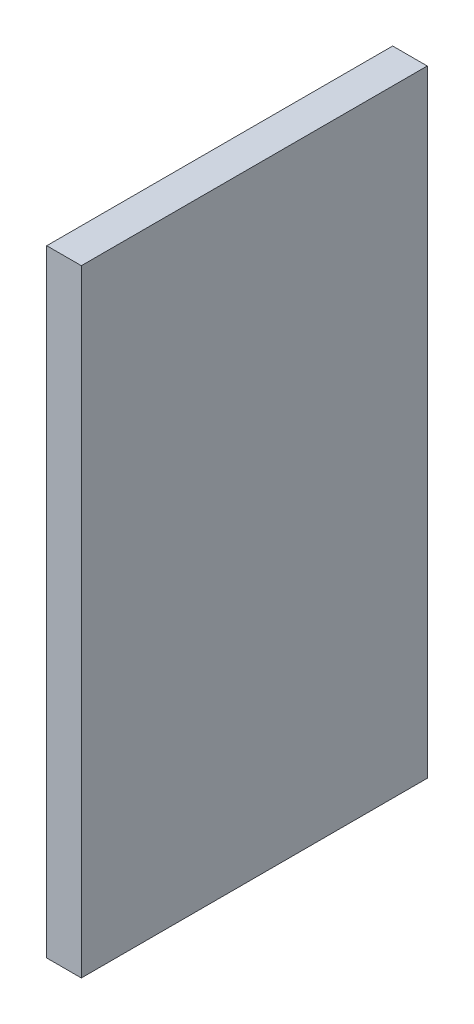
from build123d import *

# Parameters (mm, degrees)
SKETCH1_W           = 6
SKETCH1_H           = 107
BOSS_EXTRUDE1_DEPTH = 60


with BuildPart() as part:
    # Sketch1 → Boss-Extrude1 (new body)
    with BuildSketch(Plane.XY):
        Rectangle(SKETCH1_W, SKETCH1_H)
    extrude(amount=BOSS_EXTRUDE1_DEPTH)


solid = part.part
